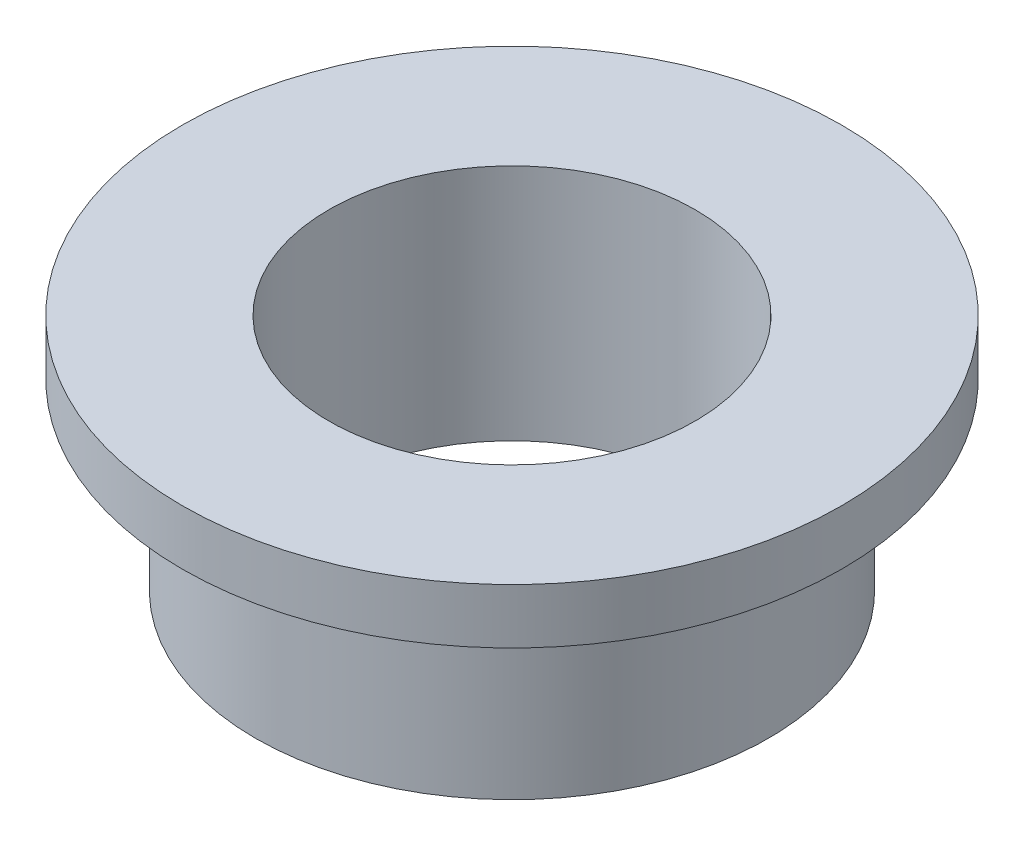
from build123d import *


with BuildPart() as part:
    # Sketch1 → Revolve1 (revolve)
    with BuildSketch(Plane.XY, mode=Mode.PRIVATE) as revolve1_sk:
        Polygon((5, 0), (5, 6.5), (9, 6.5), (9, 5), (7, 5), (7, 0), align=None)
    revolve(revolve1_sk.sketch.rotate(Axis((0, 0, 0), (0, 1, 0)), 90), axis=Axis((0, 0, 0), (0, 1, 0)))


solid = part.part
